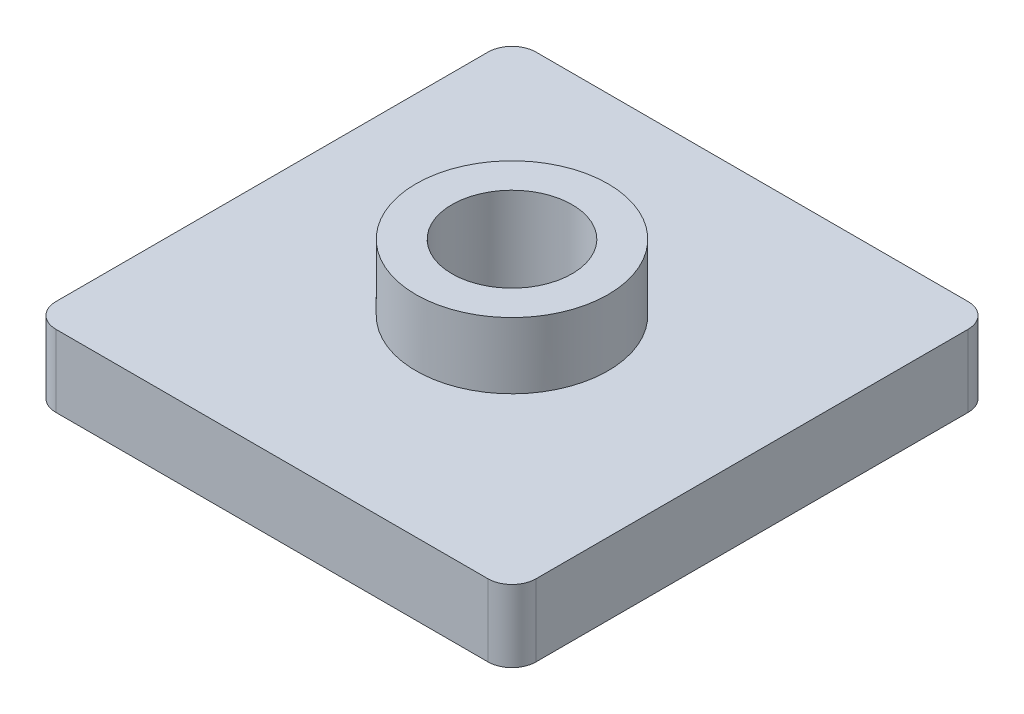
from build123d import *

# Parameters (mm, degrees)
SKETCH1_W           = 20
SKETCH1_H           = 20
BOSS_EXTRUDE1_DEPTH = 3
FILLET1_R           = 1
SKETCH1_3_R         = 4
BOSS_EXTRUDE2_DEPTH = 5.75
SKETCH2_R           = 2.5
CUT_EXTRUDE1_DEPTH  = 5.75


with BuildPart() as part:
    # Sketch1 → Boss-Extrude1 (new body)
    with BuildSketch(Plane(origin=(0, 0, 0), x_dir=(1, 0, 0), z_dir=(0, 1, 0))):
        Rectangle(SKETCH1_W, SKETCH1_H)
    extrude(amount=BOSS_EXTRUDE1_DEPTH)

    # Fillet1
    fillet1_edges = [part.edges().sort_by_distance(p)[0] for p in [
        (-10, 1.5, -10),
        (-10, 1.5, 10),
        (10, 1.5, 10),
        (10, 1.5, -10),
    ]]
    fillet(fillet1_edges, radius=FILLET1_R)

    # Sketch1<3> → Boss-Extrude2 (add)
    with BuildSketch(Plane(origin=(0, 0, 0), x_dir=(1, 0, 0), z_dir=(0, 1, 0))):
        with Locations(Location((0, 0, 0), (0, 0, 90))):
            Circle(SKETCH1_3_R)
    extrude(amount=BOSS_EXTRUDE2_DEPTH)

    # Sketch2 → Cut-Extrude1 (cut)
    with BuildSketch(Plane(origin=(0, 5.75, 0), x_dir=(1, 0, 0), z_dir=(0, 1, 0))):
        with Locations(Location((0, 0, 0), (0, 0, 270))):
            Circle(SKETCH2_R)
    extrude(amount=-CUT_EXTRUDE1_DEPTH, mode=Mode.SUBTRACT)


solid = part.part
